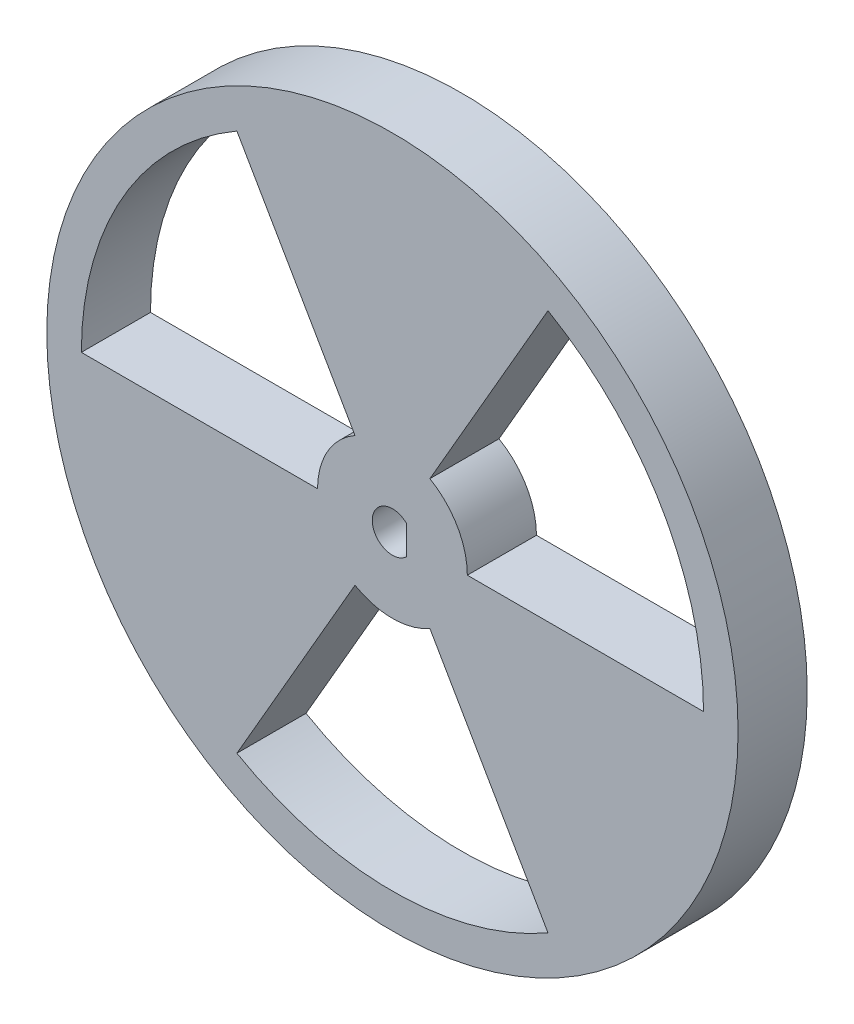
from build123d import *

# Parameters (mm, degrees)
ESQUISSE1_R        = 60
BOSS_EXTRU_1_DEPTH = 12
CUT_EXTRUDE1_DEPTH = 12


with BuildPart() as part:
    # Esquisse1 → Boss.-Extru.1 (new body)
    with BuildSketch(Plane.XY):
        Circle(ESQUISSE1_R)
        with BuildLine():
            ThreePointArc((13, 0), (11.258330249, 6.5), (6.5, 11.258330249))
            Line((6.5, 11.258330249), (27, 46.765371804))
            ThreePointArc((27, 46.765371804), (46.765371804, 27), (54, 0))
            Line((54, 0), (13, 0))
        make_face(mode=Mode.SUBTRACT)
        with BuildLine():
            Line((-27, 46.765371804), (-6.5, 11.258330249))
            ThreePointArc((-6.5, 11.258330249), (-11.258330249, 6.5), (-13, 0))
            Line((-13, 0), (-54, 0))
            ThreePointArc((-54, 0), (-46.765371804, 27), (-27, 46.765371804))
        make_face(mode=Mode.SUBTRACT)
        with BuildLine():
            Line((-27, -46.765371804), (-6.5, -11.258330249))
            ThreePointArc((-6.5, -11.258330249), (0, -13), (6.5, -11.258330249))
            Line((6.5, -11.258330249), (27, -46.765371804))
            ThreePointArc((27, -46.765371804), (0, -54), (-27, -46.765371804))
        make_face(mode=Mode.SUBTRACT)
    extrude(amount=BOSS_EXTRU_1_DEPTH)

    # Sketch1 → Cut-Extrude1 (cut)
    with BuildSketch(Plane.XY.offset(12)):
        with BuildLine():
            Line((2.449489743, 2.5), (2.449489743, -2.5))
            ThreePointArc((2.449489743, -2.5), (-3.5, 0), (2.449489743, 2.5))
        make_face()
    extrude(amount=-CUT_EXTRUDE1_DEPTH, mode=Mode.SUBTRACT)


solid = part.part
